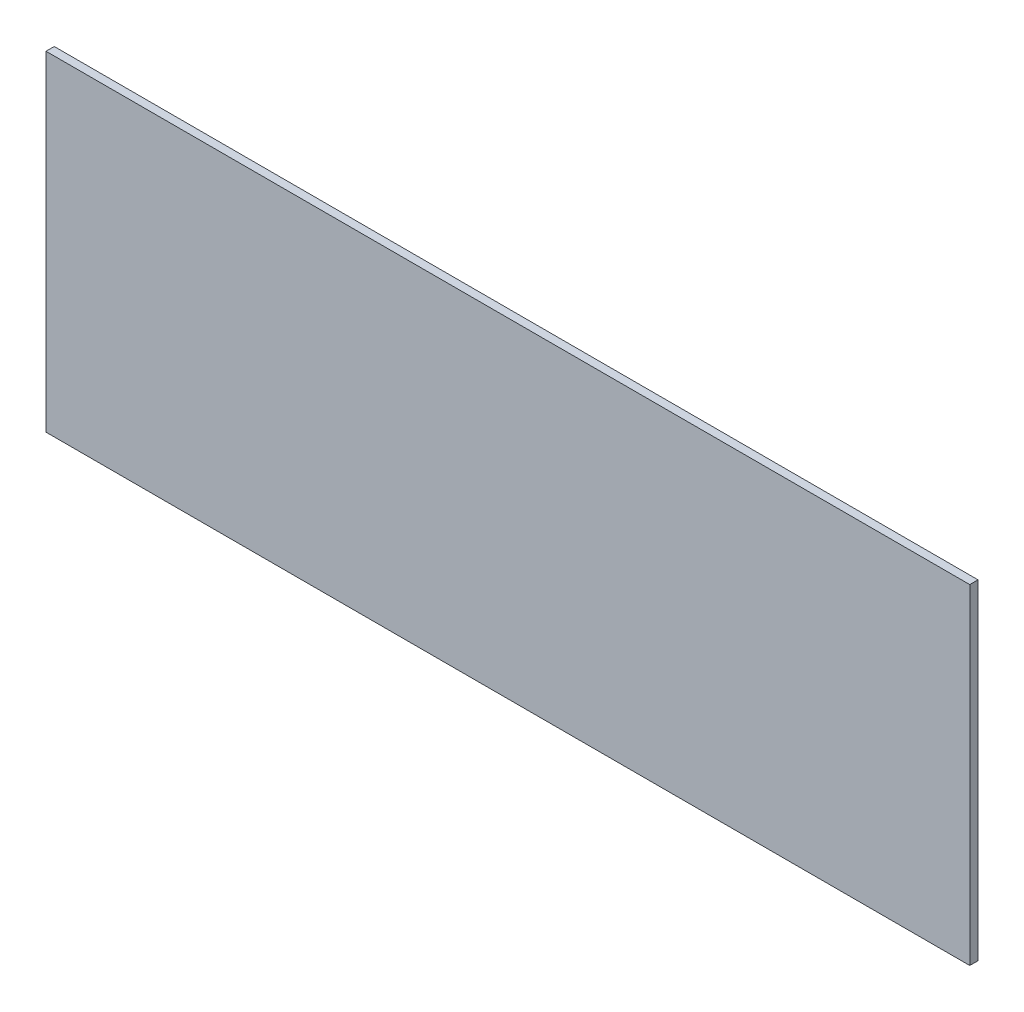
from build123d import *

# Parameters (mm, degrees)
SCHIZZO1_W                   = 280
SCHIZZO1_H                   = 100
ESTRUSIONE_ESTRUSIONE1_DEPTH = 2.5


with BuildPart() as part:
    # Schizzo1 → Estrusione-Estrusione1 (new body)
    with BuildSketch(Plane.XY):
        with Locations((140, 50)):
            Rectangle(SCHIZZO1_W, SCHIZZO1_H)
    extrude(amount=ESTRUSIONE_ESTRUSIONE1_DEPTH)


solid = part.part
